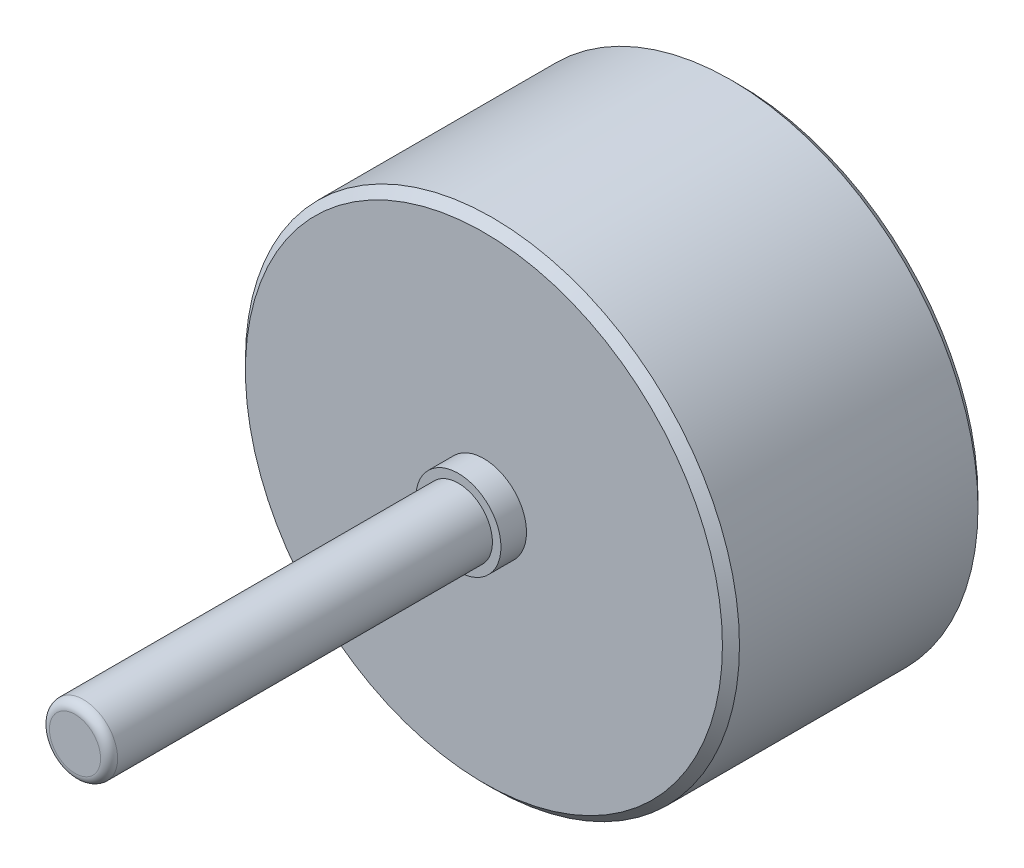
from build123d import *

# Parameters (mm, degrees)
ESQUISSE1_R             = 29
BOSS_EXTRU_1_DEPTH      = 30
ESQUISSE2_R             = 4
BOSS_EXTRU_2_DEPTH      = 10
ESQUISSE3_R             = 5
BOSS_EXTRU_3_DEPTH      = 3
ESQUISSE4_R             = 4
ENL_V_MAT_EXTRU_1_DEPTH = 5
CHANFREIN1_SIZE         = 1
ESQUISSE8_R             = 4
BOSS_EXTRU_4_DEPTH      = 38
CONG_1_R                = 1


with BuildPart() as part:
    # Esquisse1 → Boss.-Extru.1 (new body)
    with BuildSketch(Plane.XY):
        Circle(ESQUISSE1_R)
    extrude(amount=BOSS_EXTRU_1_DEPTH)

    # Esquisse2 → Boss.-Extru.2 (add)
    with BuildSketch(Plane.XY.offset(30)):
        Circle(ESQUISSE2_R)
    extrude(amount=BOSS_EXTRU_2_DEPTH)

    # Esquisse3 → Boss.-Extru.3 (add)
    with BuildSketch(Plane.XY.offset(30)):
        Circle(ESQUISSE3_R)
    extrude(amount=BOSS_EXTRU_3_DEPTH)

    # Esquisse4 → Enlèv. mat.-Extru.1 (cut)
    with BuildSketch(Plane(origin=(0, 0, 0), x_dir=(-1, 0, 0), z_dir=(0, 0, -1))):
        with Locations(Location((0, 0, 0), (0, 0, 180))):
            Circle(ESQUISSE4_R)
    extrude(amount=-ENL_V_MAT_EXTRU_1_DEPTH, mode=Mode.SUBTRACT)

    # Chanfrein1
    chanfrein1_edges = [part.edges().sort_by_distance(p)[0] for p in [
        (-29, 0, 0),
        (-29, 0, 30),
    ]]
    chamfer(chanfrein1_edges, length=CHANFREIN1_SIZE)

    # Esquisse8 → Boss.-Extru.4 (add)
    with BuildSketch(Plane.XY.offset(40)):
        Circle(ESQUISSE8_R)
    extrude(amount=BOSS_EXTRU_4_DEPTH)

    # Congé1
    cong_1_edges = [part.edges().sort_by_distance(p)[0] for p in [
        (-4, 0, 78),
    ]]
    fillet(cong_1_edges, radius=CONG_1_R)


solid = part.part
